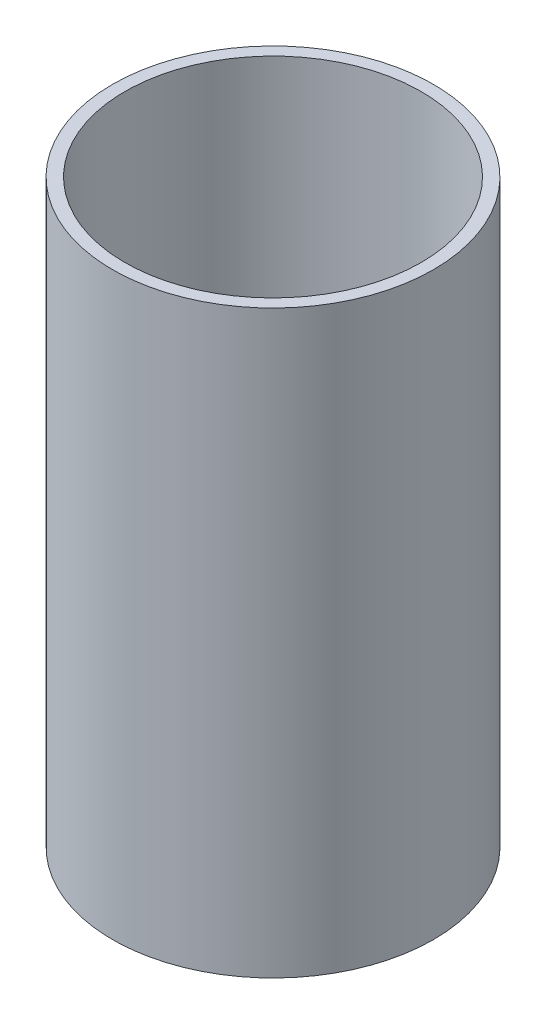
from build123d import *

# Parameters (mm, degrees)
SKETCH1_W = 6.35
SKETCH1_H = 298.45


with BuildPart() as part:
    # Sketch1 → Revolve1 (revolve)
    with BuildSketch(Plane.XY):
        with Locations((79.375, 149.225)):
            Rectangle(SKETCH1_W, SKETCH1_H)
    revolve(axis=Axis((0, 0, 0), (0, 1, 0)))


solid = part.part
